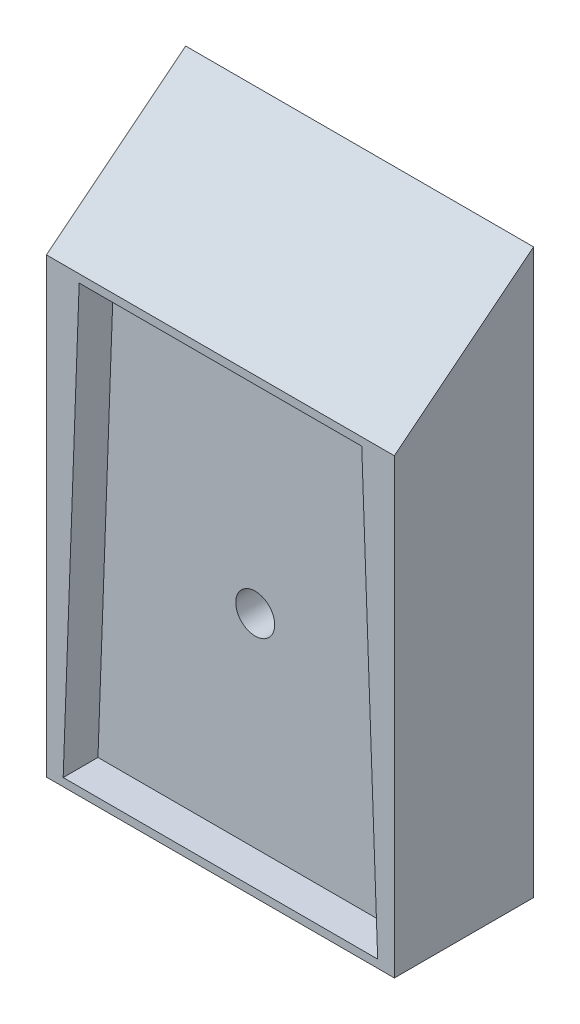
from build123d import *

# Parameters (mm, degrees)
SKICA1_W                 = 50
SKICA1_H                 = 65
P_IDAT_VYSUNUT_M1_DEPTH  = 20
P_IDAT_VYSUNUT_M2_DEPTH  = 50
ODEBRAT_VYSUNUT_M1_DEPTH = 5
SKICA8_R                 = 2.35
ODEBRAT_VYSUNUT_M4_DEPTH = 8.5
SKICA6_R                 = 2.8
ODEBRAT_VYSUNUT_M7_DEPTH = 10
SKICA7_R                 = 7.5
ODEBRAT_VYSUNUT_M8_DEPTH = 10


with BuildPart() as part:
    # Skica1 → Přidat vysunutím1 (new body)
    with BuildSketch(Plane.XY):
        Rectangle(SKICA1_W, SKICA1_H)
    extrude(amount=P_IDAT_VYSUNUT_M1_DEPTH)

    # Skica3 → Přidat vysunutím2 (add, through all)
    with BuildSketch(Plane(origin=(25, 0, 0), x_dir=(0, 0, -1), z_dir=(1, 0, 0))):
        Polygon((0, 32.5), (0, 48.5), (-20, 32.5), align=None)
    extrude(amount=-P_IDAT_VYSUNUT_M2_DEPTH)

    # Skica5 → Odebrat vysunutím1 (cut)
    with BuildSketch(Plane.XY.offset(20)):
        Polygon((-20.3, 31.35), (20.31, 31.35), (22.6, -31.35), (-22.6, -31.35), align=None)
    extrude(amount=-ODEBRAT_VYSUNUT_M1_DEPTH, mode=Mode.SUBTRACT)

    # Skica8 → Odebrat vysunutím4 (cut)
    with BuildSketch(Plane(origin=(0, 0, 0), x_dir=(-1, 0, 0), z_dir=(0, 0, -1))):
        with Locations((7.14901322, 24.75)):
            Circle(SKICA8_R)
        with Locations(Location((-7.14901322, 24.75, 0), (0, 0, 180))):
            Circle(SKICA8_R)
        with Locations(Location((7.14901322, 39.05, 0), (0, 0, 180))):
            Circle(SKICA8_R)
        with Locations((-7.14901322, 39.05)):
            Circle(SKICA8_R)
    extrude(amount=-ODEBRAT_VYSUNUT_M4_DEPTH, mode=Mode.SUBTRACT)

    # Skica6 → Odebrat vysunutím7 (cut)
    with BuildSketch(Plane.XY.offset(15)):
        with Locations((0, -2.15)):
            Circle(SKICA6_R)
    extrude(amount=-ODEBRAT_VYSUNUT_M7_DEPTH, mode=Mode.SUBTRACT)

    # Skica7 → Odebrat vysunutím8 (cut)
    with BuildSketch(Plane(origin=(0, 0, 0), x_dir=(-1, 0, 0), z_dir=(0, 0, -1))):
        with Locations((0, -2.15)):
            Circle(SKICA7_R)
    extrude(amount=-ODEBRAT_VYSUNUT_M8_DEPTH, mode=Mode.SUBTRACT)


solid = part.part
